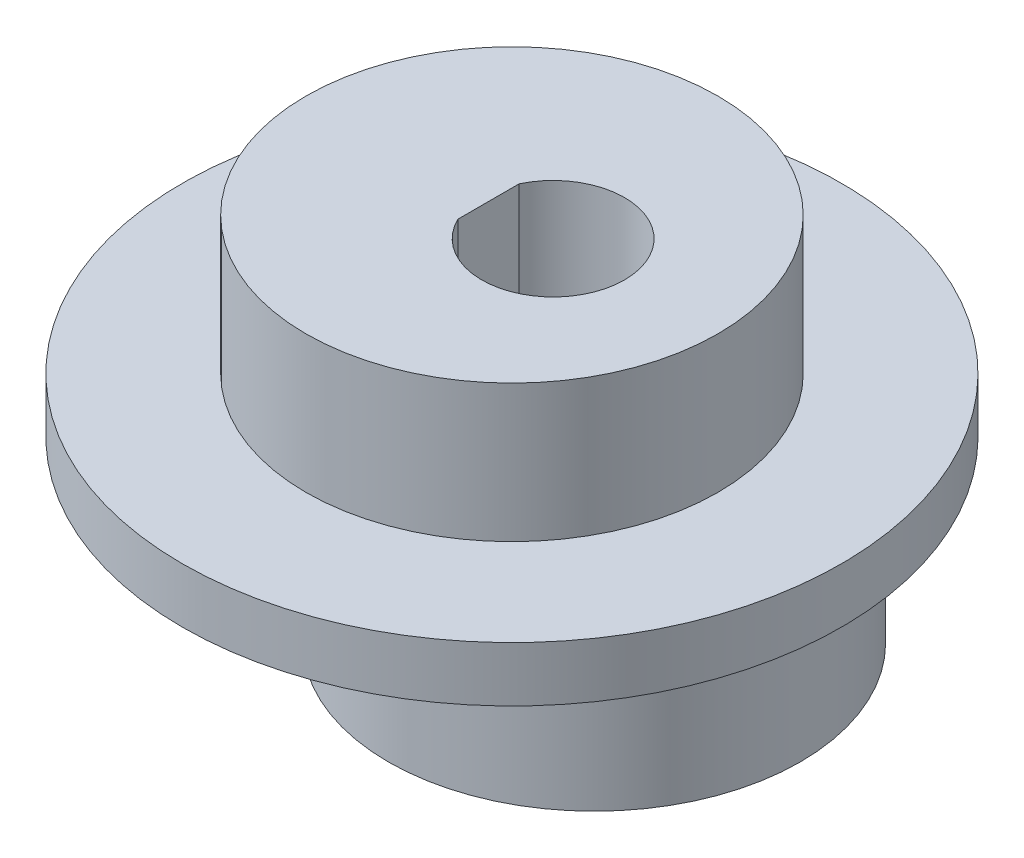
from build123d import *

# Parameters (mm, degrees)
SKETCH2_R           = 7.5
BOSS_EXTRUDE1_DEPTH = 5
SKETCH2_3_R         = 12
SKETCH2_3_R_2       = 7.5
BOSS_EXTRUDE2_DEPTH = 2
BOSS_EXTRUDE4_START = -2
SKETCH2_5_R         = 7.5
BOSS_EXTRUDE4_DEPTH = 2
SKETCH4_R           = 7.5
BOSS_EXTRUDE5_DEPTH = 5
CUT_EXTRUDE1_DEPTH  = 21.784609691


with BuildPart() as part:
    # Sketch2 → Boss-Extrude1 (new body)
    with BuildSketch(Plane(origin=(0, 0, 0), x_dir=(1, 0, 0), z_dir=(0, 1, 0))):
        Circle(SKETCH2_R)
    extrude(amount=BOSS_EXTRUDE1_DEPTH)



with BuildPart() as body_2:
    # Sketch2<3> → Boss-Extrude2 (new body)
    with BuildSketch(Plane(origin=(0, 0, 0), x_dir=(1, 0, 0), z_dir=(0, 1, 0))):
        Circle(SKETCH2_3_R)
        Circle(SKETCH2_3_R_2, mode=Mode.SUBTRACT)
    extrude(amount=-BOSS_EXTRUDE2_DEPTH)


with BuildPart() as part_1:
    add(part.part)

    add(body_2.part)  # Boss-Extrude4 merges body 2
    # Sketch2<5> → Boss-Extrude4 (add)
    with BuildSketch(Plane(origin=(0, 0, 0), x_dir=(1, 0, 0), z_dir=(0, 1, 0)).offset(BOSS_EXTRUDE4_START)):
        Circle(SKETCH2_5_R)
    extrude(amount=BOSS_EXTRUDE4_DEPTH)

    # Sketch4 → Boss-Extrude5 (add)
    with BuildSketch(Plane.XZ.offset(2)):
        with Locations((3, 0)):
            Circle(SKETCH4_R)
    extrude(amount=BOSS_EXTRUDE5_DEPTH)

    # Sketch6 → Cut-Extrude1 (cut, through all)
    with BuildSketch(Plane(origin=(0, 5, 0), x_dir=(1, 0, 0), z_dir=(0, 1, 0))):
        with BuildLine():
            Line((-0.85, -1.112429773), (-0.85, 1.112429773))
            ThreePointArc((-0.85, 1.112429773), (4.1, 0), (-0.85, -1.112429773))
        make_face()
    extrude(amount=-CUT_EXTRUDE1_DEPTH, mode=Mode.SUBTRACT)


solid = part_1.part
